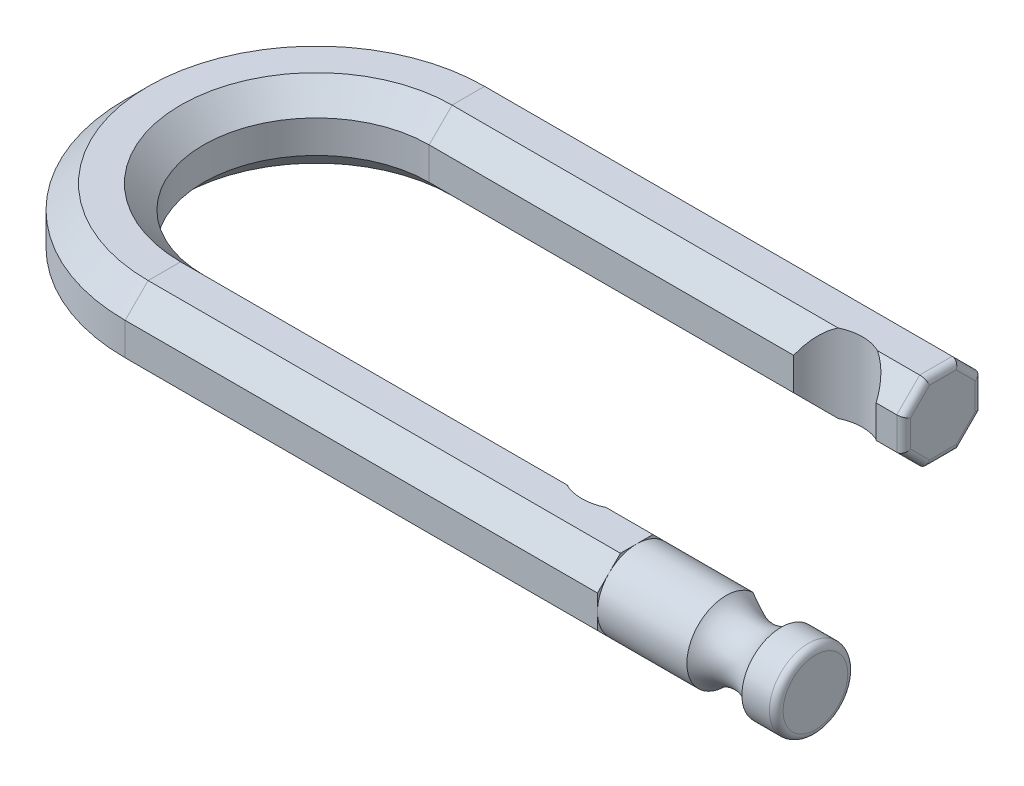
from build123d import *

# Parameters (mm, degrees)
SKETCH3_R               = 3.917718569
SKETCH3_R_2             = 3.6195
CUT_EXTRUDE1_DEPTH      = 16.51
CUT_EXTRUDE2_DEPTH      = 86.489963921
CUT_EXTRUDE2_DEPTH_BACK = 86.489963921
CUT_EXTRUDE3_DEPTH      = 86.489963921
CUT_EXTRUDE3_DEPTH_BACK = 86.489963921
FILLET1_R               = 0.635


with BuildPart() as part:
    # Sweep1: sweep along a path in Sketch1
    with BuildLine(Plane(origin=(0, 0, 0), x_dir=(1, 0, 0), z_dir=(0, 1, 0))) as sweep1_path:
        Line((0, 0), (-60.1218, 0))
        ThreePointArc((-60.1218, 0), (-77.7748, 17.653), (-60.1218, 35.306))
        Line((-60.1218, 35.306), (-16.3068, 35.306))
    # Sketch2 → Sweep1 (sweep)
    with BuildSketch(Plane(origin=(0, 0, 0), x_dir=(0, 0, -1), z_dir=(1, 0, 0))):
        Polygon((7.239, 1.499245989), (5.118745989, 3.6195), (2.120254011, 3.6195), (0, 1.499245989), (0, -1.499245989), (2.120254011, -3.6195), (5.118745989, -3.6195), (7.239, -1.499245989), align=None)
    sweep(path=sweep1_path.line)

    # Sketch3 → Cut-Extrude1 (cut)
    with BuildSketch(Plane(origin=(0, 0, 0), x_dir=(0, 0, -1), z_dir=(1, 0, 0))):
        with Locations((3.6195, 0)):
            Circle(SKETCH3_R)
        with Locations((3.6195, 0)):
            Circle(SKETCH3_R_2, mode=Mode.SUBTRACT)
    extrude(amount=-CUT_EXTRUDE1_DEPTH, mode=Mode.SUBTRACT)

    # Sketch5 → Cut-Revolve1 (revolve, cut)
    with BuildSketch(Plane(origin=(0, 0, 0), x_dir=(1, 0, 0), z_dir=(0, 1, 0))):
        with BuildLine():
            Line((-8.255, 7.239), (-3.175, 7.239))
            ThreePointArc((-3.175, 7.239), (-5.715, 6.096), (-8.255, 7.239))
        make_face()
    revolve(axis=Axis((0, 0, -3.6195), (-1, 0, 0)), mode=Mode.SUBTRACT)

    # Sketch6 → Cut-Extrude2 (cut, two sides: drawn at the far end of the back side and taken through both)
    with BuildSketch(Plane(origin=(0, 0, 0), x_dir=(1, 0, 0), z_dir=(0, 1, 0)).offset(-CUT_EXTRUDE2_DEPTH_BACK)):
        with BuildLine():
            Line((-18.8468, 28.067), (-26.4668, 28.067))
            ThreePointArc((-26.4668, 28.067), (-22.6568, 30.607), (-18.8468, 28.067))
        make_face()
        with BuildLine():
            Line((-18.8468, 7.239), (-26.4668, 7.239))
            ThreePointArc((-26.4668, 7.239), (-22.6568, 4.699), (-18.8468, 7.239))
        make_face()
    extrude(amount=CUT_EXTRUDE2_DEPTH + CUT_EXTRUDE2_DEPTH_BACK, mode=Mode.SUBTRACT)

    # Sketch7 → Cut-Extrude3 (cut, two sides: drawn at the far end of the back side and taken through both)
    with BuildSketch(Plane(origin=(0, 0, 0), x_dir=(1, 0, 0), z_dir=(0, 1, 0)).offset(-CUT_EXTRUDE3_DEPTH_BACK)):
        with BuildLine():
            Line((-5.715, 6.096), (-19.561541368, 6.096))
            ThreePointArc((-19.561541368, 6.096), (-19.157191244, 6.638122792), (-18.8468, 7.239))
            Line((-18.8468, 7.239), (-8.255, 7.239))
            ThreePointArc((-8.255, 7.239), (-7.107663725, 6.394913945), (-5.715, 6.096))
        make_face()
    extrude(amount=CUT_EXTRUDE3_DEPTH + CUT_EXTRUDE3_DEPTH_BACK, mode=Mode.SUBTRACT)

    # Fillet1
    fillet1_edges = [part.edges().sort_by_distance(p)[0] for p in [
        (-16.3068, 0, -28.067),
        (-16.3068, 2.559372995, -29.127127005),
        (-16.3068, 3.6195, -31.6865),
        (-16.3068, 2.559372995, -34.245872995),
        (-16.3068, 0, -35.306),
        (-16.3068, -2.559372995, -34.245872995),
        (-16.3068, -3.6195, -31.6865),
        (-16.3068, -2.559372995, -29.127127005),
        (0, 0, 0),
    ]]
    fillet(fillet1_edges, radius=FILLET1_R)


solid = part.part
